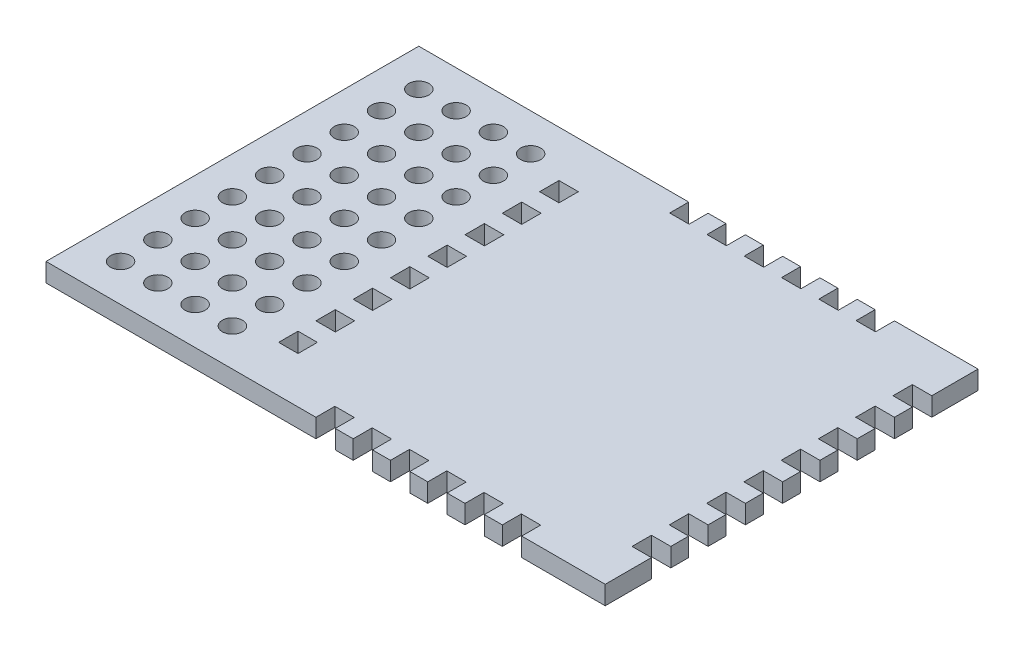
from build123d import *

# Parameters (mm, degrees)
SKETCH1_W           = 127
SKETCH1_H           = 127
BOSS_EXTRUDE1_DEPTH = 6.35
SKETCH2_W           = 6.604
SKETCH2_H           = 6.477
SKETCH2_H_2         = 6.604
CUT_EXTRUDE1_DEPTH  = 91.02678768
SKETCH3_W           = 63.5
SKETCH3_H           = 127
SKETCH3_R           = 3.429
BOSS_EXTRUDE2_DEPTH = 6.35


with BuildPart() as part:
    # Sketch1 → Boss-Extrude1 (new body)
    with BuildSketch(Plane(origin=(0, 0, 0), x_dir=(1, 0, 0), z_dir=(0, 1, 0))):
        Rectangle(SKETCH1_W, SKETCH1_H)
    extrude(amount=BOSS_EXTRUDE1_DEPTH)

    # Sketch2 → Cut-Extrude1 (cut, through all)
    with BuildSketch(Plane(origin=(0, 6.35, 0), x_dir=(1, 0, 0), z_dir=(0, 1, 0))):
        with Locations((-31.75, -60.2615)):
            Rectangle(SKETCH2_W, SKETCH2_H)
        with Locations((-19.05, -60.2615)):
            Rectangle(SKETCH2_W, SKETCH2_H)
        with Locations((-6.35, -60.2615)):
            Rectangle(SKETCH2_W, SKETCH2_H)
        with Locations((6.35, -60.2615)):
            Rectangle(SKETCH2_W, SKETCH2_H)
        with Locations((19.05, -60.2615)):
            Rectangle(SKETCH2_W, SKETCH2_H)
        with Locations((31.75, -60.2615)):
            Rectangle(SKETCH2_W, SKETCH2_H)
        with Locations((31.75, 60.2615)):
            Rectangle(SKETCH2_W, SKETCH2_H)
        with Locations((19.05, 60.2615)):
            Rectangle(SKETCH2_W, SKETCH2_H)
        with Locations((6.35, 60.2615)):
            Rectangle(SKETCH2_W, SKETCH2_H)
        with Locations((-6.35, 60.2615)):
            Rectangle(SKETCH2_W, SKETCH2_H)
        with Locations((-19.05, 60.2615)):
            Rectangle(SKETCH2_W, SKETCH2_H)
        with Locations((-31.75, 60.2615)):
            Rectangle(SKETCH2_W, SKETCH2_H)
        with Locations((-60.198, 31.75)):
            Rectangle(SKETCH2_W, SKETCH2_H_2)
        with Locations((-60.198, 19.05)):
            Rectangle(SKETCH2_W, SKETCH2_H_2)
        with Locations((-60.198, 6.35)):
            Rectangle(SKETCH2_W, SKETCH2_H_2)
        with Locations((-60.198, -6.35)):
            Rectangle(SKETCH2_W, SKETCH2_H_2)
        with Locations((-60.198, -19.05)):
            Rectangle(SKETCH2_W, SKETCH2_H_2)
        with Locations((-60.198, -31.75)):
            Rectangle(SKETCH2_W, SKETCH2_H_2)
        with Locations((60.198, -31.75)):
            Rectangle(SKETCH2_W, SKETCH2_H_2)
        with Locations((60.198, -19.05)):
            Rectangle(SKETCH2_W, SKETCH2_H_2)
        with Locations((60.198, -6.35)):
            Rectangle(SKETCH2_W, SKETCH2_H_2)
        with Locations((60.198, 6.35)):
            Rectangle(SKETCH2_W, SKETCH2_H_2)
        with Locations((60.198, 19.05)):
            Rectangle(SKETCH2_W, SKETCH2_H_2)
        with Locations((60.198, 31.75)):
            Rectangle(SKETCH2_W, SKETCH2_H_2)
        with Locations((-60.198, 44.45)):
            Rectangle(SKETCH2_W, SKETCH2_H_2)
        with Locations((-60.198, -44.45)):
            Rectangle(SKETCH2_W, SKETCH2_H_2)
        with Locations((60.198, -44.45)):
            Rectangle(SKETCH2_W, SKETCH2_H_2)
        with Locations((60.198, 44.45)):
            Rectangle(SKETCH2_W, SKETCH2_H_2)
    extrude(amount=-CUT_EXTRUDE1_DEPTH, mode=Mode.SUBTRACT)

    # Sketch3 → Boss-Extrude2 (add)
    with BuildSketch(Plane(origin=(0, 6.35, 0), x_dir=(1, 0, 0), z_dir=(0, 1, 0))):
        with Locations((-95.25, 0)):
            Rectangle(SKETCH3_W, SKETCH3_H)
        with Locations(Location((-114.3, 50.8, 0), (0, 0, 270))):
            Circle(SKETCH3_R, mode=Mode.SUBTRACT)
        with Locations(Location((-101.6, 50.8, 0), (0, 0, 270))):
            Circle(SKETCH3_R, mode=Mode.SUBTRACT)
        with Locations(Location((-101.6, 38.1, 0), (0, 0, 270))):
            Circle(SKETCH3_R, mode=Mode.SUBTRACT)
        with Locations(Location((-114.3, 38.1, 0), (0, 0, 270))):
            Circle(SKETCH3_R, mode=Mode.SUBTRACT)
        with Locations(Location((-114.3, 25.4, 0), (0, 0, 270))):
            Circle(SKETCH3_R, mode=Mode.SUBTRACT)
        with Locations(Location((-101.6, 25.4, 0), (0, 0, 270))):
            Circle(SKETCH3_R, mode=Mode.SUBTRACT)
        with Locations(Location((-88.9, 50.8, 0), (0, 0, 270))):
            Circle(SKETCH3_R, mode=Mode.SUBTRACT)
        with Locations(Location((-76.2, 50.8, 0), (0, 0, 270))):
            Circle(SKETCH3_R, mode=Mode.SUBTRACT)
        with Locations(Location((-88.9, 38.1, 0), (0, 0, 270))):
            Circle(SKETCH3_R, mode=Mode.SUBTRACT)
        with Locations(Location((-76.2, 38.1, 0), (0, 0, 270))):
            Circle(SKETCH3_R, mode=Mode.SUBTRACT)
        with Locations(Location((-88.9, 25.4, 0), (0, 0, 270))):
            Circle(SKETCH3_R, mode=Mode.SUBTRACT)
        with Locations(Location((-76.2, 25.4, 0), (0, 0, 270))):
            Circle(SKETCH3_R, mode=Mode.SUBTRACT)
        with Locations(Location((-114.3, 12.7, 0), (0, 0, 270))):
            Circle(SKETCH3_R, mode=Mode.SUBTRACT)
        with Locations(Location((-101.6, 12.7, 0), (0, 0, 270))):
            Circle(SKETCH3_R, mode=Mode.SUBTRACT)
        with Locations(Location((-88.9, 12.7, 0), (0, 0, 270))):
            Circle(SKETCH3_R, mode=Mode.SUBTRACT)
        with Locations(Location((-76.2, 12.7, 0), (0, 0, 270))):
            Circle(SKETCH3_R, mode=Mode.SUBTRACT)
        with Locations(Location((-114.3, 0, 0), (0, 0, 270))):
            Circle(SKETCH3_R, mode=Mode.SUBTRACT)
        with Locations(Location((-101.6, 0, 0), (0, 0, 270))):
            Circle(SKETCH3_R, mode=Mode.SUBTRACT)
        with Locations(Location((-88.9, 0, 0), (0, 0, 270))):
            Circle(SKETCH3_R, mode=Mode.SUBTRACT)
        with Locations(Location((-76.2, 0, 0), (0, 0, 270))):
            Circle(SKETCH3_R, mode=Mode.SUBTRACT)
        with Locations(Location((-114.3, -12.7, 0), (0, 0, 270))):
            Circle(SKETCH3_R, mode=Mode.SUBTRACT)
        with Locations(Location((-101.6, -12.7, 0), (0, 0, 270))):
            Circle(SKETCH3_R, mode=Mode.SUBTRACT)
        with Locations(Location((-88.9, -12.7, 0), (0, 0, 270))):
            Circle(SKETCH3_R, mode=Mode.SUBTRACT)
        with Locations(Location((-76.2, -12.7, 0), (0, 0, 270))):
            Circle(SKETCH3_R, mode=Mode.SUBTRACT)
        with Locations(Location((-114.3, -25.4, 0), (0, 0, 270))):
            Circle(SKETCH3_R, mode=Mode.SUBTRACT)
        with Locations(Location((-101.6, -25.4, 0), (0, 0, 270))):
            Circle(SKETCH3_R, mode=Mode.SUBTRACT)
        with Locations(Location((-88.9, -25.4, 0), (0, 0, 270))):
            Circle(SKETCH3_R, mode=Mode.SUBTRACT)
        with Locations(Location((-76.2, -25.4, 0), (0, 0, 270))):
            Circle(SKETCH3_R, mode=Mode.SUBTRACT)
        with Locations(Location((-114.3, -38.1, 0), (0, 0, 270))):
            Circle(SKETCH3_R, mode=Mode.SUBTRACT)
        with Locations(Location((-101.6, -38.1, 0), (0, 0, 270))):
            Circle(SKETCH3_R, mode=Mode.SUBTRACT)
        with Locations(Location((-88.9, -38.1, 0), (0, 0, 270))):
            Circle(SKETCH3_R, mode=Mode.SUBTRACT)
        with Locations(Location((-76.2, -38.1, 0), (0, 0, 270))):
            Circle(SKETCH3_R, mode=Mode.SUBTRACT)
        with Locations(Location((-114.3, -50.8, 0), (0, 0, 270))):
            Circle(SKETCH3_R, mode=Mode.SUBTRACT)
        with Locations(Location((-101.6, -50.8, 0), (0, 0, 270))):
            Circle(SKETCH3_R, mode=Mode.SUBTRACT)
        with Locations(Location((-88.9, -50.8, 0), (0, 0, 270))):
            Circle(SKETCH3_R, mode=Mode.SUBTRACT)
        with Locations(Location((-76.2, -50.8, 0), (0, 0, 270))):
            Circle(SKETCH3_R, mode=Mode.SUBTRACT)
    extrude(amount=-BOSS_EXTRUDE2_DEPTH)


solid = part.part
